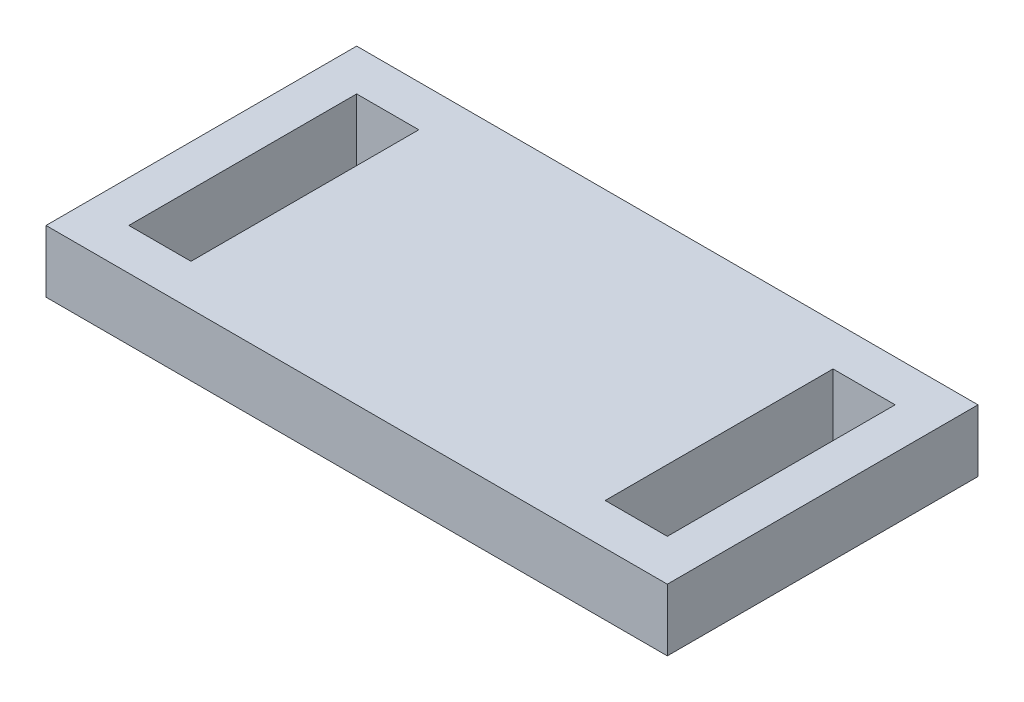
from build123d import *

# Parameters (mm, degrees)
SKETCH1_W       = 30
SKETCH1_H       = 15
MAINPLATE_DEPTH = 3
SKETCH3_W       = 3
SKETCH3_H       = 11
TABHOLES_DEPTH  = 18.036725037


with BuildPart() as part:
    # Sketch1 → MainPlate (new body)
    with BuildSketch(Plane(origin=(0, 0, 0), x_dir=(1, 0, 0), z_dir=(0, 1, 0))):
        Rectangle(SKETCH1_W, SKETCH1_H)
    extrude(amount=MAINPLATE_DEPTH)

    # Sketch3 → TabHoles (cut, through all)
    with BuildSketch(Plane(origin=(0, 3, 0), x_dir=(1, 0, 0), z_dir=(0, 1, 0))):
        with Locations((11.5, 0)):
            Rectangle(SKETCH3_W, SKETCH3_H)
        with Locations((-11.5, 0)):
            Rectangle(SKETCH3_W, SKETCH3_H)
    extrude(amount=-TABHOLES_DEPTH, mode=Mode.SUBTRACT)


solid = part.part
